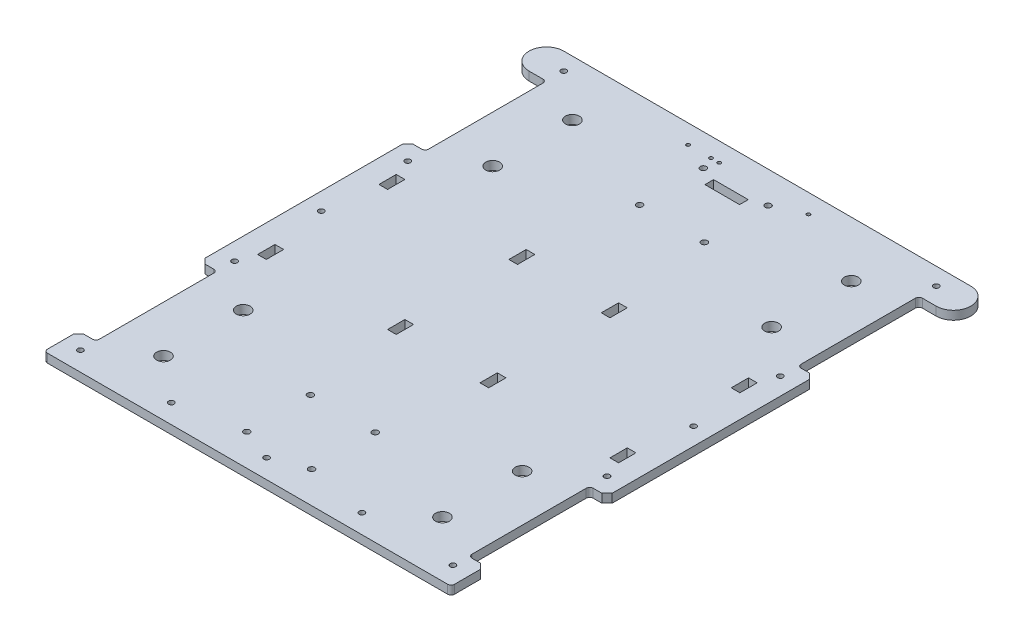
from build123d import *

# Parameters (mm, degrees)
BOSS_EXTRUDE1_DEPTH         = 5
FILLET3_RADIUS              = 10
FILLET3_LENGTH              = 5
FILLET4_RADIUS              = 10
FILLET4_LENGTH              = 5
FILLET2_R                   = 2
SKETCH2_R                   = 1.6
LAYER_FIX_HOLE_DEPTH        = 213.55881539
CHAMFER1_SIZE               = 3
MOTOR_FIX_HOLE_REACH        = 214.559
SKETCH9_R                   = 4
MOTOR_DRIVER_FIX_HOLE_REACH = 214.559
SKETCH10_R                  = 1.75
SKETCH11_R                  = 1
SKETCH11_W                  = 20
SKETCH11_H                  = 5
QTR8A_FIX_HOLE_DEPTH        = 10
SKETCH_12_W                 = 5
SKETCH_12_H                 = 10
BATTERY_FIXED_HOLE_DEPTH    = 213.55881539


with BuildPart() as part:
    # Sketch1 → Boss-Extrude1 (new body)
    with BuildSketch(Plane(origin=(0, 0, 0), x_dir=(1, 0, 0), z_dir=(0, 1, 0))):
        Polygon((-117.5, -130), (117.5, -130), (117.5, -110), (107.5, -110), (107.5, -40), (117.5, -40), (117.5, 80), (107.5, 80), (107.5, 150), (127.5, 150), (127.5, 170), (-127.5, 170), (-127.5, 150), (-107.5, 150), (-107.5, 80), (-117.5, 80), (-117.5, -40), (-107.5, -40), (-107.5, -110), (-117.5, -110), align=None)
    extrude(amount=BOSS_EXTRUDE1_DEPTH)

    # Fillet3: full round fillet: the end face becomes a half cylinder, R = half its width
    fillet3_face = Plane((127.5, 2.5, -160), x_dir=(0, 1, 0), z_dir=(1, 0, 0))  # on the end face: x along it, z out of the body
    fillet3_slab = fillet3_face.offset(-FILLET3_RADIUS / 2) * Box(FILLET3_LENGTH, 2 * FILLET3_RADIUS, FILLET3_RADIUS, mode=Mode.PRIVATE)  # the body's end, R deep
    fillet3_round = Plane((117.5, 2.5, -160), x_dir=(1, 0, 0), z_dir=(0, 1, 0)) * Cylinder(FILLET3_RADIUS, FILLET3_LENGTH, mode=Mode.PRIVATE)  # its axis R under the face
    add(fillet3_slab - fillet3_round, mode=Mode.SUBTRACT)

    # Fillet4: full round fillet: the end face becomes a half cylinder, R = half its width
    fillet4_face = Plane((-127.5, 2.5, -160), x_dir=(0, 1, 0), z_dir=(-1, 0, 0))  # on the end face: x along it, z out of the body
    fillet4_slab = fillet4_face.offset(-FILLET4_RADIUS / 2) * Box(FILLET4_LENGTH, 2 * FILLET4_RADIUS, FILLET4_RADIUS, mode=Mode.PRIVATE)  # the body's end, R deep
    fillet4_round = Plane((-117.5, 2.5, -160), x_dir=(-1, 0, 0), z_dir=(0, 1, 0)) * Cylinder(FILLET4_RADIUS, FILLET4_LENGTH, mode=Mode.PRIVATE)  # its axis R under the face
    add(fillet4_slab - fillet4_round, mode=Mode.SUBTRACT)

    # Fillet2
    fillet2_edges = [part.edges().sort_by_distance(p)[0] for p in [
        (117.5, 2.5, 130),
        (-117.5, 2.5, 130),
        (-107.5, 2.5, 110),
        (-107.5, 2.5, 40),
        (-107.5, 2.5, -80),
        (-107.5, 2.5, -150),
        (107.5, 2.5, -150),
        (107.5, 2.5, -80),
        (107.5, 2.5, 40),
        (107.5, 2.5, 110),
    ]]
    fillet(fillet2_edges, radius=FILLET2_R)

    # Sketch2 → layer fix hole (cut, through all)
    with BuildSketch(Plane(origin=(0, 5, 0), x_dir=(1, 0, 0), z_dir=(0, 1, 0))):
        with Locations(Location((107.5, 160, 0), (0, 0, 270))):
            Circle(SKETCH2_R)
        with Locations(Location((107.5, 20, 0), (0, 0, 270))):
            Circle(SKETCH2_R)
        with Locations(Location((107.5, -119, 0), (0, 0, 270))):
            Circle(SKETCH2_R)
        with Locations(Location((0, -119, 0), (0, 0, 90))):
            Circle(SKETCH2_R)
        with Locations(Location((-107.5, -119, 0), (0, 0, 90))):
            Circle(SKETCH2_R)
        with Locations(Location((-107.5, 20, 0), (0, 0, 90))):
            Circle(SKETCH2_R)
        with Locations(Location((-107.5, 160, 0), (0, 0, 90))):
            Circle(SKETCH2_R)
        with Locations(Location((55, -119, 0), (0, 0, 90))):
            Circle(SKETCH2_R)
        with Locations(Location((-55, -119, 0), (0, 0, 90))):
            Circle(SKETCH2_R)
        with Locations(Location((-107.5, 70, 0), (0, 0, 90))):
            Circle(SKETCH2_R)
        with Locations(Location((107.5, 70, 0), (0, 0, 270))):
            Circle(SKETCH2_R)
        with Locations(Location((-107.5, -30, 0), (0, 0, 90))):
            Circle(SKETCH2_R)
        with Locations(Location((107.5, -30, 0), (0, 0, 270))):
            Circle(SKETCH2_R)
    extrude(amount=-LAYER_FIX_HOLE_DEPTH, mode=Mode.SUBTRACT)

    # Chamfer1
    chamfer1_edges = [part.edges().sort_by_distance(p)[0] for p in [
        (-117.5, 2.5, 110),
        (-117.5, 2.5, 40),
        (-117.5, 2.5, -80),
        (117.5, 2.5, -80),
        (117.5, 2.5, 40),
        (117.5, 2.5, 110),
    ]]
    chamfer(chamfer1_edges, length=CHAMFER1_SIZE)

    # Sketch9 → Motor fix hole (cut, up to next)
    with BuildSketch(Plane.XZ, mode=Mode.PRIVATE) as motor_fix_hole_sk1:
        with Locations(Location((-80.5, -138, 0), (0, 0, 270))):
            Circle(SKETCH9_R)
    motor_fix_hole_tool1 = extrude(motor_fix_hole_sk1.sketch, amount=-MOTOR_FIX_HOLE_REACH, mode=Mode.PRIVATE) & part.part
    # Sketch9 → Motor fix hole (cut, up to next)
    with BuildSketch(Plane.XZ, mode=Mode.PRIVATE) as motor_fix_hole_sk2:
        with Locations(Location((-80.5, -92, 0), (0, 0, 90))):
            Circle(SKETCH9_R)
    motor_fix_hole_tool2 = extrude(motor_fix_hole_sk2.sketch, amount=-MOTOR_FIX_HOLE_REACH, mode=Mode.PRIVATE) & part.part
    # Sketch9 → Motor fix hole (cut, up to next)
    with BuildSketch(Plane.XZ, mode=Mode.PRIVATE) as motor_fix_hole_sk3:
        with Locations(Location((80.5, -92, 0), (0, 0, 270))):
            Circle(SKETCH9_R)
    motor_fix_hole_tool3 = extrude(motor_fix_hole_sk3.sketch, amount=-MOTOR_FIX_HOLE_REACH, mode=Mode.PRIVATE) & part.part
    # Sketch9 → Motor fix hole (cut, up to next)
    with BuildSketch(Plane.XZ, mode=Mode.PRIVATE) as motor_fix_hole_sk4:
        with Locations(Location((80.5, -138, 0), (0, 0, 90))):
            Circle(SKETCH9_R)
    motor_fix_hole_tool4 = extrude(motor_fix_hole_sk4.sketch, amount=-MOTOR_FIX_HOLE_REACH, mode=Mode.PRIVATE) & part.part
    # Sketch9 → Motor fix hole (cut, up to next)
    with BuildSketch(Plane.XZ, mode=Mode.PRIVATE) as motor_fix_hole_sk5:
        with Locations(Location((80.5, 98, 0), (0, 0, 270))):
            Circle(SKETCH9_R)
    motor_fix_hole_tool5 = extrude(motor_fix_hole_sk5.sketch, amount=-MOTOR_FIX_HOLE_REACH, mode=Mode.PRIVATE) & part.part
    # Sketch9 → Motor fix hole (cut, up to next)
    with BuildSketch(Plane.XZ, mode=Mode.PRIVATE) as motor_fix_hole_sk6:
        with Locations(Location((80.5, 52, 0), (0, 0, 90))):
            Circle(SKETCH9_R)
    motor_fix_hole_tool6 = extrude(motor_fix_hole_sk6.sketch, amount=-MOTOR_FIX_HOLE_REACH, mode=Mode.PRIVATE) & part.part
    # Sketch9 → Motor fix hole (cut, up to next)
    with BuildSketch(Plane.XZ, mode=Mode.PRIVATE) as motor_fix_hole_sk7:
        with Locations(Location((-80.5, 98, 0), (0, 0, 90))):
            Circle(SKETCH9_R)
    motor_fix_hole_tool7 = extrude(motor_fix_hole_sk7.sketch, amount=-MOTOR_FIX_HOLE_REACH, mode=Mode.PRIVATE) & part.part
    # Sketch9 → Motor fix hole (cut, up to next)
    with BuildSketch(Plane.XZ, mode=Mode.PRIVATE) as motor_fix_hole_sk8:
        with Locations(Location((-80.5, 52, 0), (0, 0, 270))):
            Circle(SKETCH9_R)
    motor_fix_hole_tool8 = extrude(motor_fix_hole_sk8.sketch, amount=-MOTOR_FIX_HOLE_REACH, mode=Mode.PRIVATE) & part.part
    add(motor_fix_hole_tool1.solids().sort_by_distance((-80.5, 0, -138))[0], mode=Mode.SUBTRACT)
    add(motor_fix_hole_tool2.solids().sort_by_distance((-80.5, 0, -92))[0], mode=Mode.SUBTRACT)
    add(motor_fix_hole_tool3.solids().sort_by_distance((80.5, 0, -92))[0], mode=Mode.SUBTRACT)
    add(motor_fix_hole_tool4.solids().sort_by_distance((80.5, 0, -138))[0], mode=Mode.SUBTRACT)
    add(motor_fix_hole_tool5.solids().sort_by_distance((80.5, 0, 98))[0], mode=Mode.SUBTRACT)
    add(motor_fix_hole_tool6.solids().sort_by_distance((80.5, 0, 52))[0], mode=Mode.SUBTRACT)
    add(motor_fix_hole_tool7.solids().sort_by_distance((-80.5, 0, 98))[0], mode=Mode.SUBTRACT)
    add(motor_fix_hole_tool8.solids().sort_by_distance((-80.5, 0, 52))[0], mode=Mode.SUBTRACT)

    # Sketch10 → Motor driver fix hole (cut, up to next)
    with BuildSketch(Plane.XZ, mode=Mode.PRIVATE) as motor_driver_fix_hole_sk1:
        with Locations(Location((18.68975044, 75, 0), (0, 0, 270))):
            Circle(SKETCH10_R)
    motor_driver_fix_hole_tool1 = extrude(motor_driver_fix_hole_sk1.sketch, amount=-MOTOR_DRIVER_FIX_HOLE_REACH, mode=Mode.PRIVATE) & part.part
    # Sketch10 → Motor driver fix hole (cut, up to next)
    with BuildSketch(Plane.XZ, mode=Mode.PRIVATE) as motor_driver_fix_hole_sk2:
        with Locations(Location((-18.68975044, 75, 0), (0, 0, 270))):
            Circle(SKETCH10_R)
    motor_driver_fix_hole_tool2 = extrude(motor_driver_fix_hole_sk2.sketch, amount=-MOTOR_DRIVER_FIX_HOLE_REACH, mode=Mode.PRIVATE) & part.part
    # Sketch10 → Motor driver fix hole (cut, up to next)
    with BuildSketch(Plane.XZ, mode=Mode.PRIVATE) as motor_driver_fix_hole_sk3:
        with Locations(Location((-18.68975044, 111.74180032, 0), (0, 0, 270))):
            Circle(SKETCH10_R)
    motor_driver_fix_hole_tool3 = extrude(motor_driver_fix_hole_sk3.sketch, amount=-MOTOR_DRIVER_FIX_HOLE_REACH, mode=Mode.PRIVATE) & part.part
    # Sketch10 → Motor driver fix hole (cut, up to next)
    with BuildSketch(Plane.XZ, mode=Mode.PRIVATE) as motor_driver_fix_hole_sk4:
        with Locations(Location((18.68975044, 111.74180032, 0), (0, 0, 270))):
            Circle(SKETCH10_R)
    motor_driver_fix_hole_tool4 = extrude(motor_driver_fix_hole_sk4.sketch, amount=-MOTOR_DRIVER_FIX_HOLE_REACH, mode=Mode.PRIVATE) & part.part
    # Sketch10 → Motor driver fix hole (cut, up to next)
    with BuildSketch(Plane.XZ, mode=Mode.PRIVATE) as motor_driver_fix_hole_sk5:
        with Locations(Location((18.68975044, -151.74180032, 0), (0, 0, 90))):
            Circle(SKETCH10_R)
    motor_driver_fix_hole_tool5 = extrude(motor_driver_fix_hole_sk5.sketch, amount=-MOTOR_DRIVER_FIX_HOLE_REACH, mode=Mode.PRIVATE) & part.part
    # Sketch10 → Motor driver fix hole (cut, up to next)
    with BuildSketch(Plane.XZ, mode=Mode.PRIVATE) as motor_driver_fix_hole_sk6:
        with Locations(Location((-18.68975044, -151.74180032, 0), (0, 0, 90))):
            Circle(SKETCH10_R)
    motor_driver_fix_hole_tool6 = extrude(motor_driver_fix_hole_sk6.sketch, amount=-MOTOR_DRIVER_FIX_HOLE_REACH, mode=Mode.PRIVATE) & part.part
    # Sketch10 → Motor driver fix hole (cut, up to next)
    with BuildSketch(Plane.XZ, mode=Mode.PRIVATE) as motor_driver_fix_hole_sk7:
        with Locations(Location((-18.68975044, -115, 0), (0, 0, 90))):
            Circle(SKETCH10_R)
    motor_driver_fix_hole_tool7 = extrude(motor_driver_fix_hole_sk7.sketch, amount=-MOTOR_DRIVER_FIX_HOLE_REACH, mode=Mode.PRIVATE) & part.part
    # Sketch10 → Motor driver fix hole (cut, up to next)
    with BuildSketch(Plane.XZ, mode=Mode.PRIVATE) as motor_driver_fix_hole_sk8:
        with Locations(Location((18.68975044, -115, 0), (0, 0, 90))):
            Circle(SKETCH10_R)
    motor_driver_fix_hole_tool8 = extrude(motor_driver_fix_hole_sk8.sketch, amount=-MOTOR_DRIVER_FIX_HOLE_REACH, mode=Mode.PRIVATE) & part.part
    add(motor_driver_fix_hole_tool1.solids().sort_by_distance((18.68975, 0, 75))[0], mode=Mode.SUBTRACT)
    add(motor_driver_fix_hole_tool2.solids().sort_by_distance((-18.68975, 0, 75))[0], mode=Mode.SUBTRACT)
    add(motor_driver_fix_hole_tool3.solids().sort_by_distance((-18.68975, 0, 111.7418))[0], mode=Mode.SUBTRACT)
    add(motor_driver_fix_hole_tool4.solids().sort_by_distance((18.68975, 0, 111.7418))[0], mode=Mode.SUBTRACT)
    add(motor_driver_fix_hole_tool5.solids().sort_by_distance((18.68975, 0, -151.7418))[0], mode=Mode.SUBTRACT)
    add(motor_driver_fix_hole_tool6.solids().sort_by_distance((-18.68975, 0, -151.7418))[0], mode=Mode.SUBTRACT)
    add(motor_driver_fix_hole_tool7.solids().sort_by_distance((-18.68975, 0, -115))[0], mode=Mode.SUBTRACT)
    add(motor_driver_fix_hole_tool8.solids().sort_by_distance((18.68975, 0, -115))[0], mode=Mode.SUBTRACT)

    # Sketch11 → QTR8a fix hole (cut)
    with BuildSketch(Plane.XZ):
        with Locations(Location((-34.737301465, -159, 0), (0, 0, 270))):
            Circle(SKETCH11_R)
        with Locations(Location((-21.513799845, -159, 0), (0, 0, 270))):
            Circle(SKETCH11_R)
        with Locations(Location((-16.814799845, -159, 0), (0, 0, 270))):
            Circle(SKETCH11_R)
        with Locations(Location((34.737301775, -159, 0), (0, 0, 270))):
            Circle(SKETCH11_R)
        with Locations((0, -146.5)):
            Rectangle(SKETCH11_W, SKETCH11_H)
    extrude(amount=-QTR8A_FIX_HOLE_DEPTH, mode=Mode.SUBTRACT)

    # Sketch 12 → Battery fixed hole (cut, through all)
    with BuildSketch(Plane(origin=(0, 5, 0), x_dir=(1, 0, 0), z_dir=(0, 1, 0))):
        with Locations((26.666666667, 55)):
            Rectangle(SKETCH_12_W, SKETCH_12_H)
        with Locations((101.666666667, 55)):
            Rectangle(SKETCH_12_W, SKETCH_12_H)
        with Locations((26.666666667, -15)):
            Rectangle(SKETCH_12_W, SKETCH_12_H)
        with Locations((101.666666667, -15)):
            Rectangle(SKETCH_12_W, SKETCH_12_H)
        with Locations((-101.666666667, 55)):
            Rectangle(SKETCH_12_W, SKETCH_12_H)
        with Locations((-26.666666667, 55)):
            Rectangle(SKETCH_12_W, SKETCH_12_H)
        with Locations((-101.666666667, -15)):
            Rectangle(SKETCH_12_W, SKETCH_12_H)
        with Locations((-26.666666667, -15)):
            Rectangle(SKETCH_12_W, SKETCH_12_H)
    extrude(amount=-BATTERY_FIXED_HOLE_DEPTH, mode=Mode.SUBTRACT)


solid = part.part
